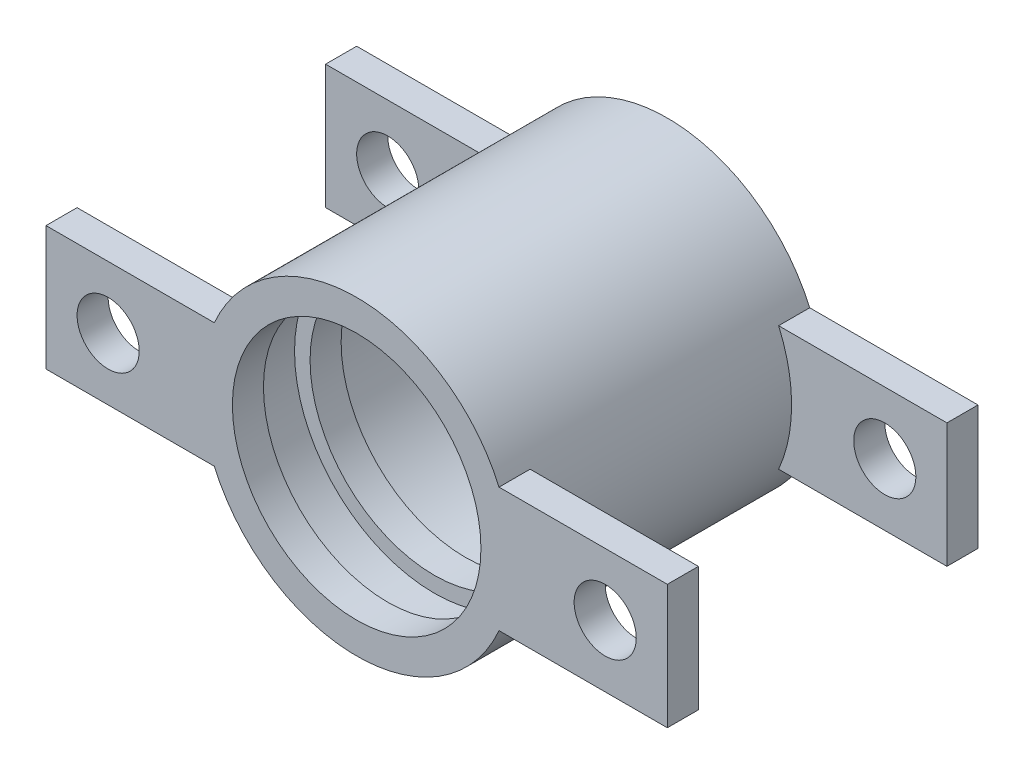
from build123d import *

# Parameters (mm, degrees)
SKETCH2_R           = 10
BOSS_EXTRUDE1_DEPTH = 10


with BuildPart() as part:
    # Sketch1 → Revolve1 (revolve)
    with BuildSketch(Plane(origin=(0, 0, 0), x_dir=(1, 0, 0), z_dir=(0, 1, 0))):
        Polygon((-50, 50), (-50, -50), (-45, -50), (-40, -50), (-40, -40), (-45, -40), (-45, -25), (-40, -25), (-40, -15), (-45, -15), (-45, 15), (-40, 15), (-40, 25), (-45, 25), (-45, 40), (-40, 40), (-40, 50), (-45, 50), align=None)
    revolve(axis=Axis((0, 0, -100.912408759), (0, 0, 1)))

    # Sketch2 → Boss-Extrude1 (add)
    # profile 1 of 2: a face of its own
    with BuildSketch(Plane.XY.offset(50)):
        with BuildLine():
            Line((45.82575695, 20), (100, 20))
            Line((100, 20), (100, -20))
            Line((100, -20), (45.82575695, -20))
            ThreePointArc((45.82575695, -20), (50, 0), (45.82575695, 20))
        make_face()
        with Locations((80, 0)):
            Circle(SKETCH2_R, mode=Mode.SUBTRACT)
    # profile 2 of 2: a face of its own
    with BuildSketch(Plane.XY.offset(50)):
        with BuildLine():
            Line((-100, 20), (-100, -20))
            Line((-100, -20), (-45.82575695, -20))
            ThreePointArc((-45.82575695, -20), (-50, 0), (-45.82575695, 20))
            Line((-45.82575695, 20), (-100, 20))
        make_face()
        with Locations((-80, 0)):
            Circle(SKETCH2_R, mode=Mode.SUBTRACT)
    boss_extrude1 = extrude(amount=-BOSS_EXTRUDE1_DEPTH)

    # Mirror1: Boss-Extrude1 across plane
    add(boss_extrude1.mirror(Plane.XY))


solid = part.part
